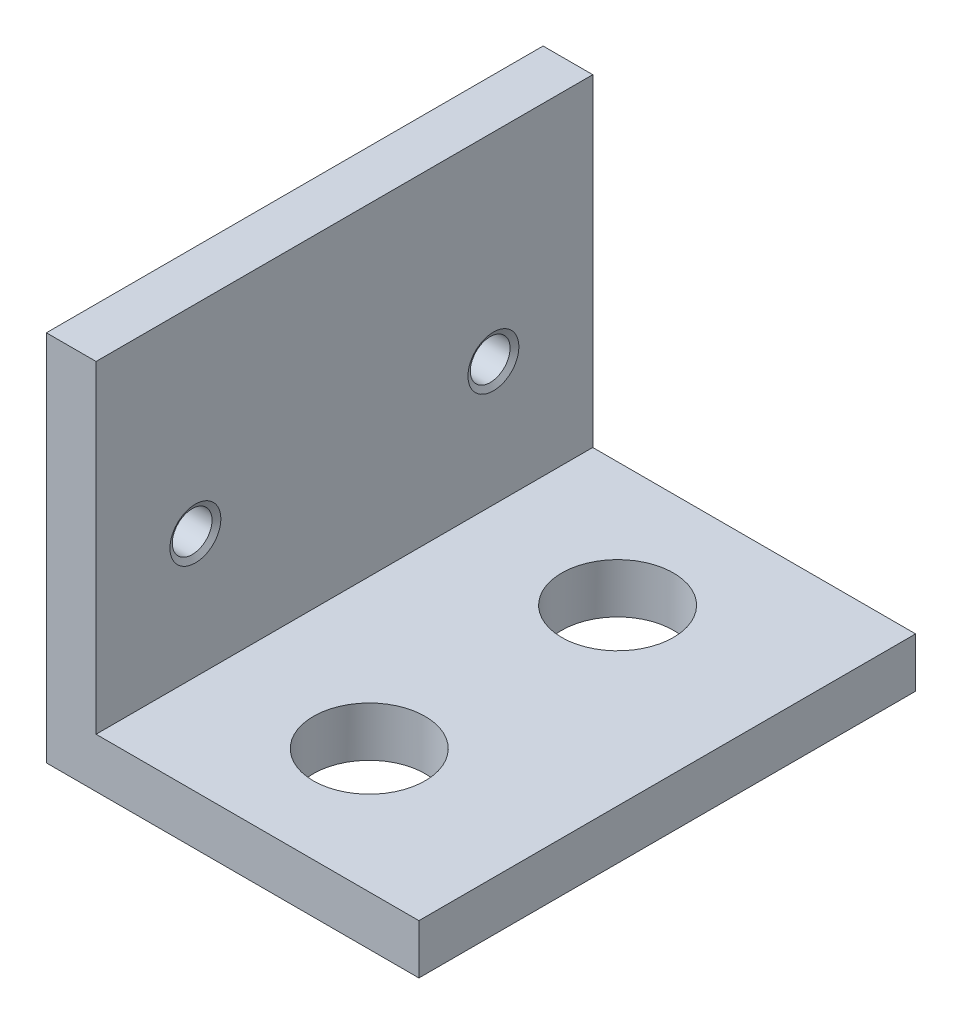
from build123d import *

# Parameters (mm, degrees)
EXTRUDE_1_DEPTH             = 20
HOLE_WIZARD_M41_D           = 4.5
HOLE_WIZARD_M41_DEPTH       = 5
HOLE_WIZARD_M41_TIP         = 1.351936393
HOLE_WIZARD_M21_D           = 1.6
HOLE_WIZARD_M21_DEPTH       = 6
HOLE_WIZARD_M21_CSINK_D     = 2.05
HOLE_WIZARD_M21_CSINK_ANGLE = 120
HOLE_WIZARD_M21_TIP         = 0.480688495


with BuildPart() as part:
    # Эскиз1 → Бобышка-Вытянуть1 (new body)
    with BuildSketch(Plane.XY):
        Polygon((0, 0), (0, 15), (2, 15), (2, 2), (15, 2), (15, 0), align=None)
    extrude(amount=EXTRUDE_1_DEPTH)

    # Отверстие с зазором M41
    with Locations(Plane(origin=(0, 2, 0), x_dir=(-1, 0, 0), z_dir=(0, 1, 0))):
        with Locations((-8, 5), (-8, 15)):
            Hole(HOLE_WIZARD_M41_D / 2, depth=HOLE_WIZARD_M41_DEPTH)
            with Locations((0, 0, -(HOLE_WIZARD_M41_DEPTH + HOLE_WIZARD_M41_TIP / 2))):  # 118° drill point
                Cone(0, HOLE_WIZARD_M41_D / 2, HOLE_WIZARD_M41_TIP, mode=Mode.SUBTRACT)

    # Отверстие обработанное метчиком M21
    with Locations(Plane(origin=(2, 0, 0), x_dir=(0, 0, -1), z_dir=(1, 0, 0))):
        with Locations((-4, 7), (-16, 7)):
            CounterSinkHole(HOLE_WIZARD_M21_D / 2, HOLE_WIZARD_M21_CSINK_D / 2, depth=HOLE_WIZARD_M21_DEPTH, counter_sink_angle=HOLE_WIZARD_M21_CSINK_ANGLE)
            with Locations((0, 0, -(HOLE_WIZARD_M21_DEPTH + HOLE_WIZARD_M21_TIP / 2))):  # 118° drill point
                Cone(0, HOLE_WIZARD_M21_D / 2, HOLE_WIZARD_M21_TIP, mode=Mode.SUBTRACT)


solid = part.part
